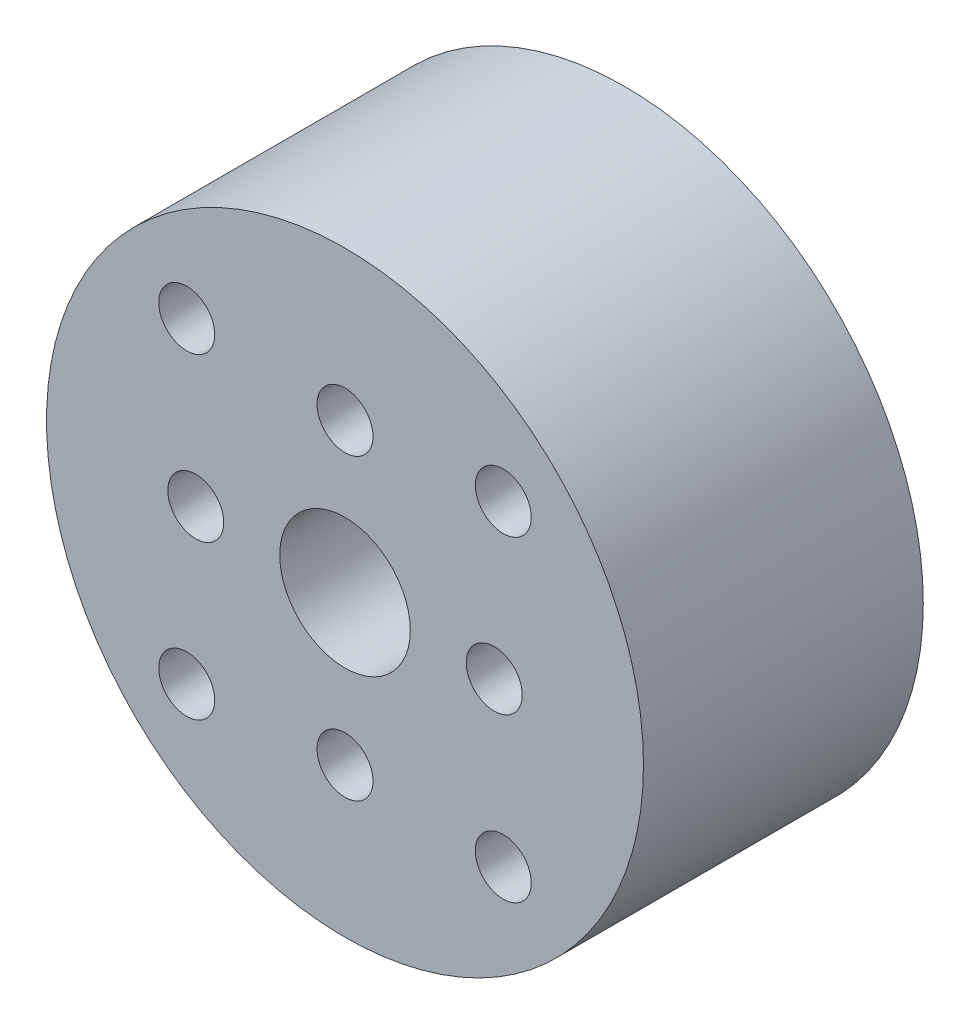
from build123d import *

# Parameters (mm, degrees)
SKETCH_1_R      = 16
SKETCH_1_R_2    = 1.5
SKETCH_1_R_3    = 3.5
EXTRUDE_1_DEPTH = 15


with BuildPart() as part:
    # 草图1 → 凸台-拉伸1 (new body)
    with BuildSketch(Plane.XY):
        Circle(SKETCH_1_R)
        with Locations((0, 8)):
            Circle(SKETCH_1_R_2, mode=Mode.SUBTRACT)
        with Locations((8, 0)):
            Circle(SKETCH_1_R_2, mode=Mode.SUBTRACT)
        with Locations((0, -8)):
            Circle(SKETCH_1_R_2, mode=Mode.SUBTRACT)
        with Locations((-8, 0)):
            Circle(SKETCH_1_R_2, mode=Mode.SUBTRACT)
        with Locations((8.485281374, 8.485281374)):
            Circle(SKETCH_1_R_2, mode=Mode.SUBTRACT)
        with Locations((8.485281374, -8.485281374)):
            Circle(SKETCH_1_R_2, mode=Mode.SUBTRACT)
        with Locations((-8.485281374, -8.485281374)):
            Circle(SKETCH_1_R_2, mode=Mode.SUBTRACT)
        with Locations((-8.485281374, 8.485281374)):
            Circle(SKETCH_1_R_2, mode=Mode.SUBTRACT)
        Circle(SKETCH_1_R_3, mode=Mode.SUBTRACT)
    extrude(amount=EXTRUDE_1_DEPTH)


solid = part.part
